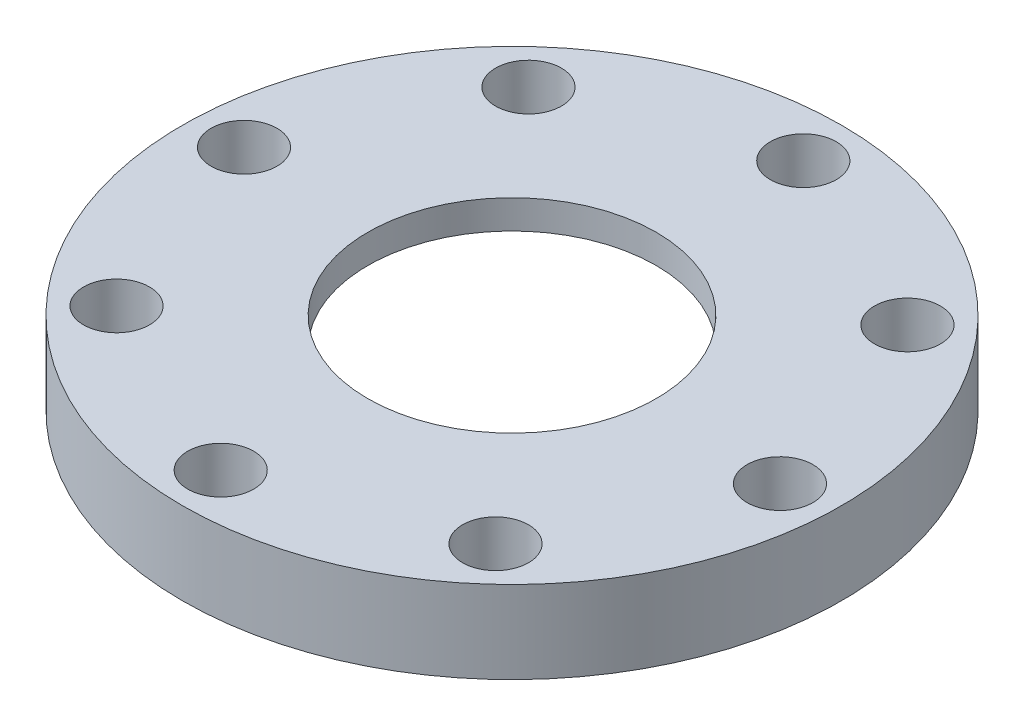
from build123d import *

# Parameters (mm, degrees)
SKETCH1_R           = 40
BOSS_EXTRUDE1_DEPTH = 10
SKETCH3_R           = 27.5
CUT_EXTRUDE2_DEPTH  = 6.5
SKETCH4_R           = 17.5
CUT_EXTRUDE3_DEPTH  = 58.445626465
SKETCH5_R           = 4
CUT_EXTRUDE4_DEPTH  = 58.445626465


with BuildPart() as part:
    # Sketch1 → Boss-Extrude1 (new body)
    with BuildSketch(Plane(origin=(0, 0, 0), x_dir=(1, 0, 0), z_dir=(0, 1, 0))):
        with Locations(Location((0, 0, 0), (0, 0, 270))):
            Circle(SKETCH1_R)
    extrude(amount=BOSS_EXTRUDE1_DEPTH)

    # Sketch3 → Cut-Extrude2 (cut)
    with BuildSketch(Plane.XZ):
        with Locations(Location((0, 0, 0), (0, 0, 270))):
            Circle(SKETCH3_R)
    extrude(amount=-CUT_EXTRUDE2_DEPTH, mode=Mode.SUBTRACT)

    # Sketch4 → Cut-Extrude3 (cut, through all)
    with BuildSketch(Plane(origin=(0, 10, 0), x_dir=(1, 0, 0), z_dir=(0, 1, 0))):
        with Locations(Location((0, 0, 0), (0, 0, 270))):
            Circle(SKETCH4_R)
    extrude(amount=-CUT_EXTRUDE3_DEPTH, mode=Mode.SUBTRACT)

    # Sketch5 → Cut-Extrude4 (cut, through all)
    with BuildSketch(Plane.XZ):
        with Locations(Location((-25, 23, 0), (0, 0, 270))):
            Circle(SKETCH5_R)
        with Locations(Location((-1.414213562, 33.941125497, 0), (0, 0, 270))):
            Circle(SKETCH5_R)
        with Locations(Location((23, 25, 0), (0, 0, 270))):
            Circle(SKETCH5_R)
        with Locations(Location((33.941125497, 1.414213562, 0), (0, 0, 270))):
            Circle(SKETCH5_R)
        with Locations(Location((25, -23, 0), (0, 0, 270))):
            Circle(SKETCH5_R)
        with Locations(Location((1.414213562, -33.941125497, 0), (0, 0, 270))):
            Circle(SKETCH5_R)
        with Locations(Location((-23, -25, 0), (0, 0, 270))):
            Circle(SKETCH5_R)
        with Locations(Location((-33.941125497, -1.414213562, 0), (0, 0, 270))):
            Circle(SKETCH5_R)
    extrude(amount=-CUT_EXTRUDE4_DEPTH, mode=Mode.SUBTRACT)


solid = part.part
